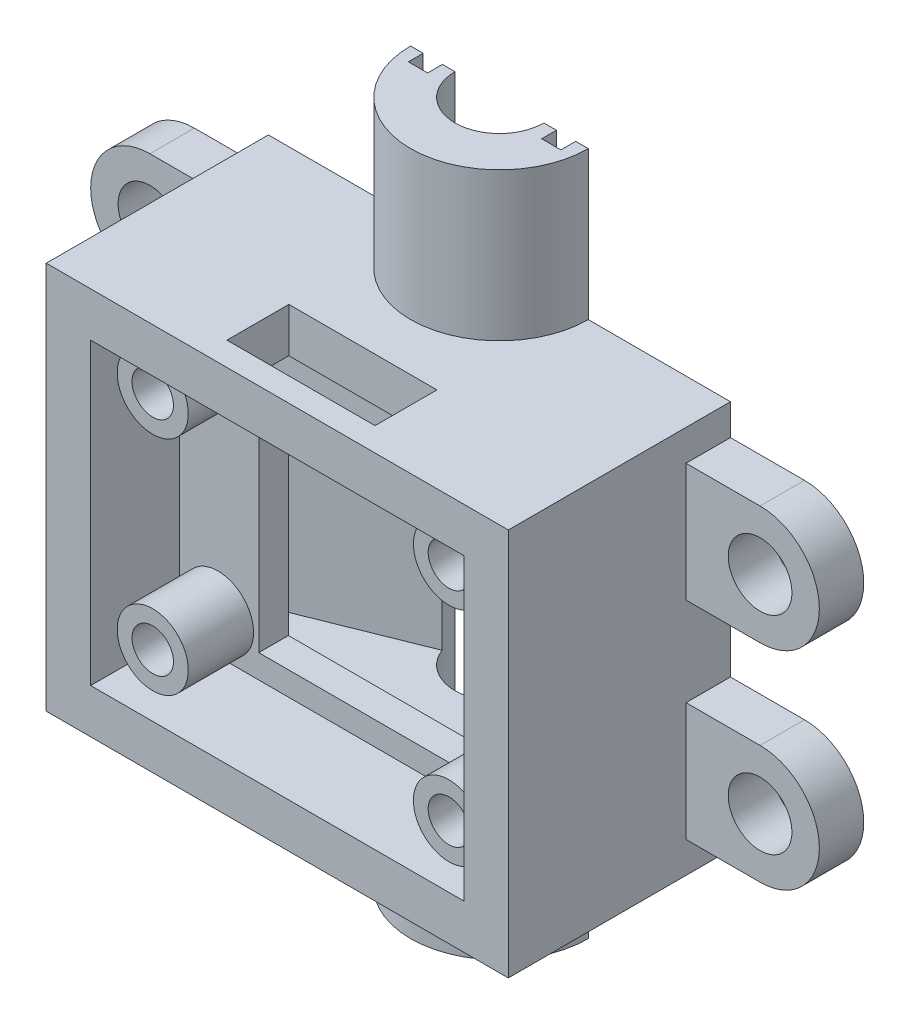
from build123d import *

# Parameters (mm, degrees)
SKETCH1_W            = 31.2
SKETCH1_H            = 26.2
BOSS_EXTRUDE1_DEPTH  = 15
SHELL2_T             = -3
BOSS_EXTRUDE2_DEPTH  = 10
CUT_EXTRUDE2_DEPTH   = 43.175822458
SKETCH8_R            = 2.15
BOSS_EXTRUDE5_DEPTH  = 3
CUT_EXTRUDE7_DEPTH   = 1
SKETCH14_W           = 25.2
SKETCH14_H           = 20.2
CUT_EXTRUDE5_DEPTH   = 36.815778646
BOSS_EXTRUDE8_REACH  = 45.959
BOSS_EXTRUDE9_START  = -8
SKETCH15_W           = 31.2
SKETCH15_H           = 26.2
SKETCH15_W_2         = 14.5
SKETCH15_H_2         = 17
BOSS_EXTRUDE9_DEPTH  = 2
SKETCH16_R           = 2.4
SKETCH16_R_2         = 1.4
BOSS_EXTRUDE10_DEPTH = 4.41
CUT_EXTRUDE6_REACH   = 48.267
SKETCH5_W            = 10
SKETCH5_H            = 4.18


with BuildPart() as part:
    # Sketch1 → Boss-Extrude1 (new body)
    with BuildSketch(Plane.XY):
        Rectangle(SKETCH1_W, SKETCH1_H)
    extrude(amount=BOSS_EXTRUDE1_DEPTH)

    # Shell2
    shell2_openings = [part.faces().sort_by_distance(p)[0] for p in [
        (0, 0, 0),
    ]]
    offset(amount=SHELL2_T, openings=shell2_openings, kind=Kind.INTERSECTION)

    # Sketch3 → Boss-Extrude2 (add)
    with BuildSketch(Plane(origin=(0, 13.1, 0), x_dir=(1, 0, 0), z_dir=(0, 1, 0))):
        with BuildLine():
            Line((-6, 0), (-3, 0))
            ThreePointArc((-3, 0), (0, -3), (3, 0))
            Line((3, 0), (6, 0))
            ThreePointArc((6, 0), (0, -6), (-6, 0))
        make_face()
    boss_extrude2 = extrude(amount=BOSS_EXTRUDE2_DEPTH)

    # Mirror1: Boss-Extrude2 across plane
    add(boss_extrude2.mirror(Plane.ZX))

    # Sketch4 → Cut-Extrude2 (cut, through all)
    with BuildSketch(Plane(origin=(0, 13.1, 0), x_dir=(1, 0, 0), z_dir=(0, 1, 0))):
        with BuildLine():
            Line((-3, 0), (3, 0))
            ThreePointArc((3, 0), (0, -3), (-3, 0))
        make_face()
    extrude(amount=-CUT_EXTRUDE2_DEPTH, mode=Mode.SUBTRACT)

    # Sketch8 → Boss-Extrude5 (add)
    # profile 1 of 2: a face of its own
    with BuildSketch(Plane(origin=(0, 0, 0), x_dir=(-1, 0, 0), z_dir=(0, 0, -1))):
        with BuildLine():
            Line((-15.6, 3), (-15.6, 11))
            Line((-15.6, 11), (-20.6, 11))
            ThreePointArc((-20.6, 11), (-24.6, 7), (-20.6, 3))
            Line((-20.6, 3), (-15.6, 3))
        make_face()
        with Locations((-20.6, 7)):
            Circle(SKETCH8_R, mode=Mode.SUBTRACT)
    # profile 2 of 2: a face of its own
    with BuildSketch(Plane(origin=(0, 0, 0), x_dir=(-1, 0, 0), z_dir=(0, 0, -1))):
        with BuildLine():
            Line((-15.6, -11), (-15.6, -3))
            Line((-15.6, -3), (-20.6, -3))
            ThreePointArc((-20.6, -3), (-24.6, -7), (-20.6, -11))
            Line((-20.6, -11), (-15.6, -11))
        make_face()
        with Locations((-20.6, -7)):
            Circle(SKETCH8_R, mode=Mode.SUBTRACT)
    boss_extrude5 = extrude(amount=-BOSS_EXTRUDE5_DEPTH)

    # Sketch7 → Cut-Extrude7 (cut)
    with BuildSketch(Plane(origin=(0, 0, 0), x_dir=(-1, 0, 0), z_dir=(0, 0, -1))):
        Polygon((-3.85, -23.1), (-3.85, -10.95), (-13.45, -10.95), (-13.45, 10.95), (-3.85, 10.95), (-3.85, 23.1), (-5.15, 23.1), (-5.15, 12.25), (-14.75, 12.25), (-14.75, -12.25), (-5.15, -12.25), (-5.15, -23.1), align=None)
    cut_extrude7 = extrude(amount=-CUT_EXTRUDE7_DEPTH, mode=Mode.SUBTRACT)

    # Mirror3: Boss-Extrude5, Cut-Extrude7 across plane
    add(boss_extrude5.mirror(Plane(origin=(0, 0, 0), x_dir=(0, 0, 1), z_dir=(1, 0, 0))))
    add(cut_extrude7.mirror(Plane(origin=(0, 0, 0), x_dir=(0, 0, 1), z_dir=(1, 0, 0))), mode=Mode.SUBTRACT)

    # Sketch14 → Cut-Extrude5 (cut, through all)
    with BuildSketch(Plane(origin=(0, 0, 12), x_dir=(-1, 0, 0), z_dir=(0, 0, -1))):
        Rectangle(SKETCH14_W, SKETCH14_H)
    extrude(amount=-CUT_EXTRUDE5_DEPTH, mode=Mode.SUBTRACT)

    # Sketch11 → Boss-Extrude8 (add, up to next)
    with BuildSketch(Plane(origin=(0, -10.1, 0), x_dir=(1, 0, 0), z_dir=(0, 1, 0)), mode=Mode.PRIVATE) as boss_extrude8_sk1:
        with BuildLine():
            Line((3, 0), (12.6, 0))
            Line((12.6, 0), (12.6, -5.002969955))
            Line((12.6, -5.002969955), (2.801311304, -1.073617705))
            ThreePointArc((2.801311304, -1.073617705), (2.949909652, -0.545924027), (3, 0))
        make_face()
    boss_extrude8_tool1 = extrude(boss_extrude8_sk1.sketch, amount=BOSS_EXTRUDE8_REACH, mode=Mode.PRIVATE) - part.part
    # Sketch11 → Boss-Extrude8 (add, up to next)
    with BuildSketch(Plane(origin=(0, -10.1, 0), x_dir=(1, 0, 0), z_dir=(0, 1, 0)), mode=Mode.PRIVATE) as boss_extrude8_sk2:
        with BuildLine():
            Line((-12.6, -5.002969955), (-2.801311304, -1.073617705))
            ThreePointArc((-2.801311304, -1.073617705), (-2.949909652, -0.545924027), (-3, 0))
            Line((-3, 0), (-12.6, 0))
            Line((-12.6, 0), (-12.6, -5.002969955))
        make_face()
    boss_extrude8_tool2 = extrude(boss_extrude8_sk2.sketch, amount=BOSS_EXTRUDE8_REACH, mode=Mode.PRIVATE) - part.part
    add(boss_extrude8_tool1.solids().sort_by_distance((8.785084, -10.1, 1.737296))[0])
    add(boss_extrude8_tool2.solids().sort_by_distance((-8.785084, -10.1, 1.737296))[0])

    # Sketch15 → Boss-Extrude9 (add)
    with BuildSketch(Plane.XY.offset(15).offset(BOSS_EXTRUDE9_START)):
        Rectangle(SKETCH15_W, SKETCH15_H)
        Rectangle(SKETCH15_W_2, SKETCH15_H_2, mode=Mode.SUBTRACT)
    extrude(amount=BOSS_EXTRUDE9_DEPTH)

    # Sketch16 → Boss-Extrude10 (add)
    # profile 1 of 4: a face of its own
    with BuildSketch(Plane.XY.offset(9)):
        with Locations((-10, 7.5)):
            Circle(SKETCH16_R)
        with Locations((-10, 7.5)):
            Circle(SKETCH16_R_2, mode=Mode.SUBTRACT)
    # profile 2 of 4: a face of its own
    with BuildSketch(Plane.XY.offset(9)):
        with Locations((10, 7.5)):
            Circle(SKETCH16_R)
        with Locations((10, 7.5)):
            Circle(SKETCH16_R_2, mode=Mode.SUBTRACT)
    # profile 3 of 4: a face of its own
    with BuildSketch(Plane.XY.offset(9)):
        with Locations((-10, -7.5)):
            Circle(SKETCH16_R)
        with Locations((-10, -7.5)):
            Circle(SKETCH16_R_2, mode=Mode.SUBTRACT)
    # profile 4 of 4: a face of its own
    with BuildSketch(Plane.XY.offset(9)):
        with Locations((10, -7.5)):
            Circle(SKETCH16_R)
        with Locations((10, -7.5)):
            Circle(SKETCH16_R_2, mode=Mode.SUBTRACT)
    extrude(amount=BOSS_EXTRUDE10_DEPTH)

    # Sketch5 → Cut-Extrude6 (cut, up to next)
    with BuildSketch(Plane(origin=(0, 13.1, 0), x_dir=(1, 0, 0), z_dir=(0, 1, 0)), mode=Mode.PRIVATE) as cut_extrude6_sk1:
        with Locations((0, -11.31)):
            Rectangle(SKETCH5_W, SKETCH5_H)
    cut_extrude6_tool1 = extrude(cut_extrude6_sk1.sketch, amount=-CUT_EXTRUDE6_REACH, mode=Mode.PRIVATE) & part.part
    add(cut_extrude6_tool1.solids().sort_by_distance((0, 13.1, 11.31))[0], mode=Mode.SUBTRACT)


solid = part.part
